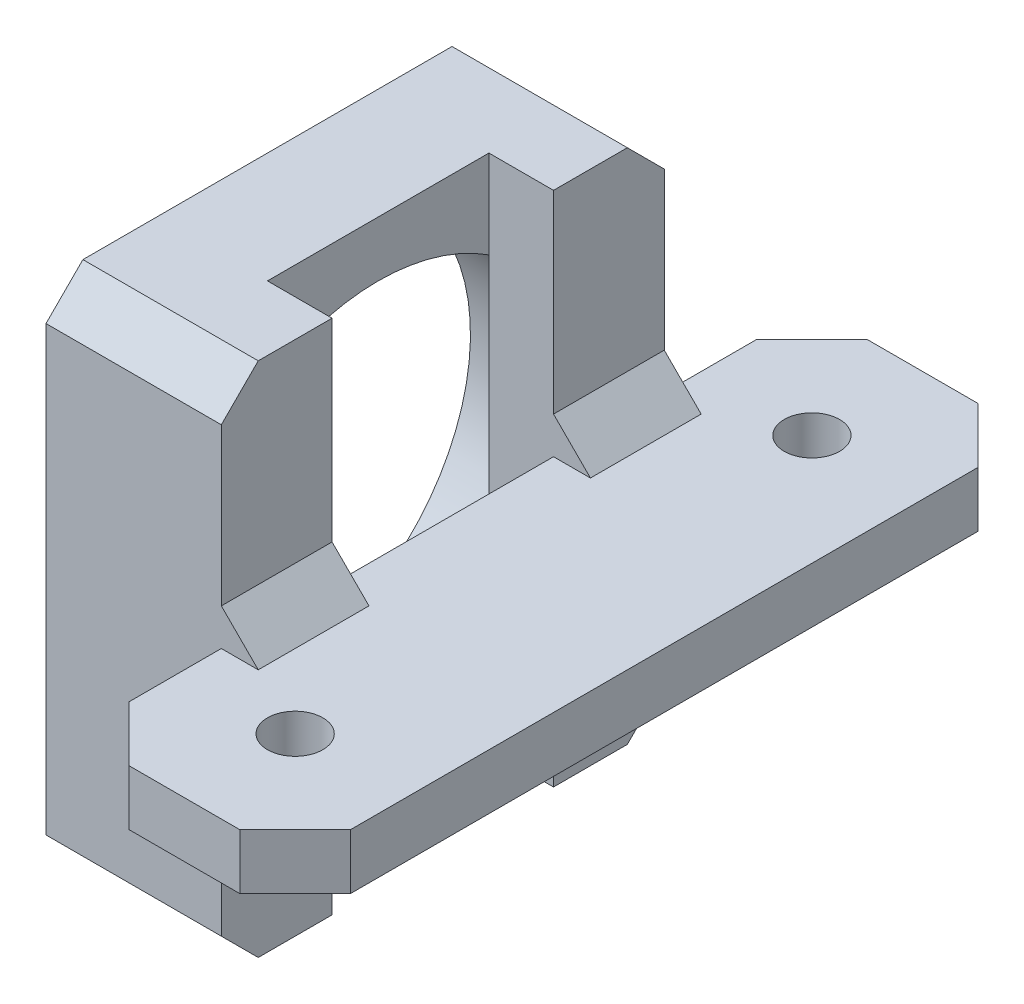
from build123d import *

# Parameters (mm, degrees)
SKETCH1_R           = 1.5
BOSS_EXTRUDE1_DEPTH = 3
BOSS_EXTRUDE2_START = 12.5
SKETCH2_W           = 3.5
SKETCH2_H           = 6
BOSS_EXTRUDE2_DEPTH = 28
CHAMFER2_SIZE       = 2
SKETCH3_W           = 24
SKETCH3_H           = 28
SKETCH3_R           = 11
BOSS_EXTRUDE4_DEPTH = 6
CHAMFER3_SIZE       = 2


with BuildPart() as part:
    # Sketch1 → Boss-Extrude1 (new body)
    with BuildSketch(Plane(origin=(0, 0, 0), x_dir=(1, 0, 0), z_dir=(0, 1, 0))):
        Polygon((-6, 17), (-3, 20), (3, 20), (6, 17), (6, -17), (3, -20), (-3, -20), (-6, -17), align=None)
        with Locations(Location((0, 14, 0), (0, 0, 270))):
            Circle(SKETCH1_R, mode=Mode.SUBTRACT)
        with Locations(Location((0, -14, 0), (0, 0, 270))):
            Circle(SKETCH1_R, mode=Mode.SUBTRACT)
    extrude(amount=BOSS_EXTRUDE1_DEPTH)

    # Sketch2 → Boss-Extrude2 (add)
    with BuildSketch(Plane(origin=(0, 3, 0), x_dir=(1, 0, 0), z_dir=(0, 1, 0)).offset(BOSS_EXTRUDE2_START)):
        with Locations((-7.75, 9)):
            Rectangle(SKETCH2_W, SKETCH2_H)
        with Locations((-7.75, -9)):
            Rectangle(SKETCH2_W, SKETCH2_H)
    extrude(amount=-BOSS_EXTRUDE2_DEPTH)

    # Chamfer2
    chamfer2_edges = [part.edges().sort_by_distance(p)[0] for p in [
        (-6, 0, -9),
        (-6, 0, 9),
        (-6, 3, -9),
        (-6, 3, 9),
    ]]
    chamfer(chamfer2_edges, length=CHAMFER2_SIZE)

    # Sketch3 → Boss-Extrude4 (add)
    with BuildSketch(Plane.ZY.offset(9.5)):
        with Locations((0, 1.5)):
            Rectangle(SKETCH3_W, SKETCH3_H)
        with Locations(Location((0, 1.5, 0), (0, 0, 236.944268849))):
            Circle(SKETCH3_R, mode=Mode.SUBTRACT)
    extrude(amount=BOSS_EXTRUDE4_DEPTH)

    # Chamfer3
    chamfer3_edges = [part.edges().sort_by_distance(p)[0] for p in [
        (-10.75, 15.5, -12),
        (-10.75, -12.5, -12),
        (-10.75, -12.5, 12),
        (-10.75, 15.5, 12),
    ]]
    chamfer(chamfer3_edges, length=CHAMFER3_SIZE)


solid = part.part
